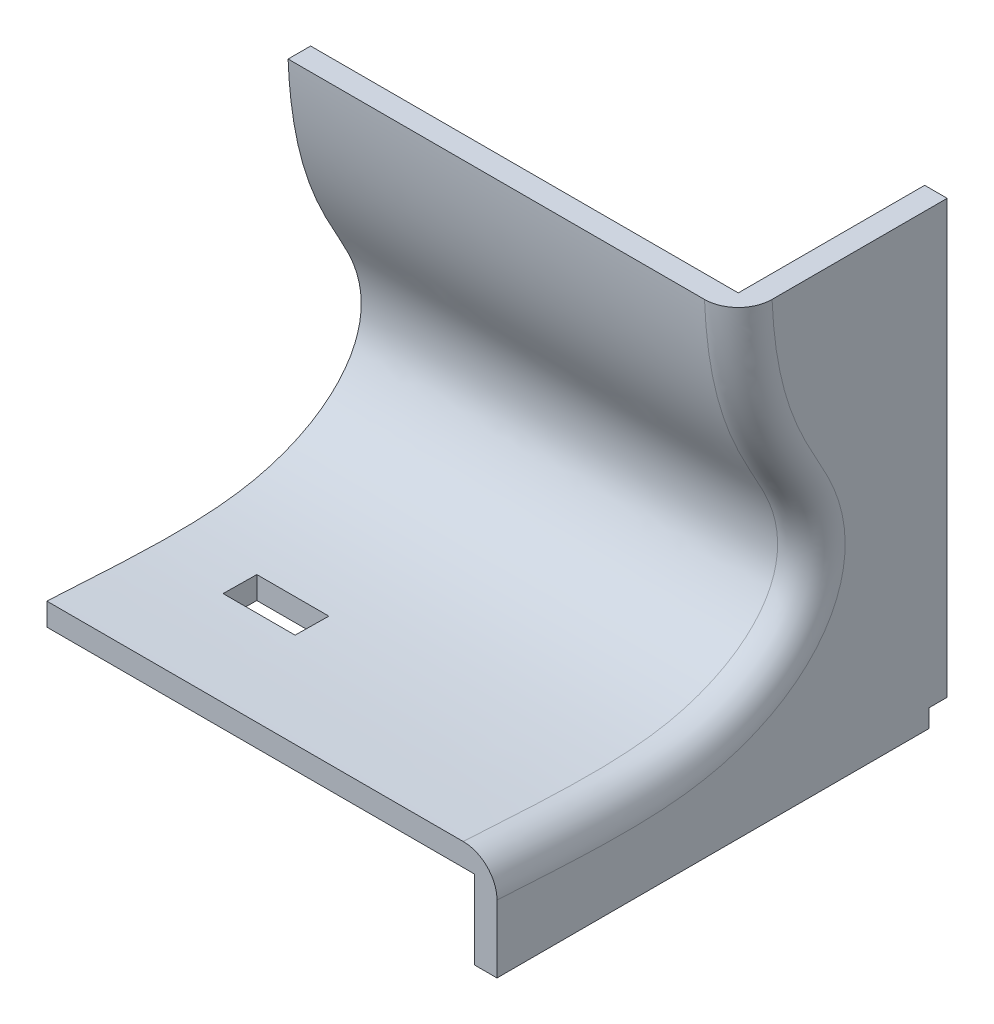
from build123d import *

# Parameters (mm, degrees)
SKETCH_1_W           = 80
SKETCH_1_H           = 100
EXTRUDE_1_DEPTH      = 100
SKETCH_2_W           = 80
SKETCH_2_H           = 85
CUT_EXTRUDE_1_DEPTH  = 90
CUT_EXTRUDE_5_DEPTH  = 138.477270849
SHELL_2_T            = -2
FILLET_1_R           = 3
FILLET_2_R           = 5
FILLET_3_R           = 3
SKETCH_6_W           = 3.8
SKETCH_6_H           = 2.5
CUT_EXTRUDE_6_DEPTH  = 85
SKETCH_8_W           = 6.4
SKETCH_8_H           = 3
CUT_EXTRUDE_7_DEPTH  = 100
SKETCH_11_W          = 2
SKETCH_11_H          = 1
CUT_EXTRUDE_8_DEPTH  = 119.74342103
SCALE_1_SCALE        = 5
SKETCH_12_W          = 400
SKETCH_12_H          = 300
SKETCH_12_W_2        = 185
SKETCH_12_H_2        = 29.670884313
CUT_EXTRUDE_11_DEPTH = 594.717104512
SKETCH_14_W          = 200
SKETCH_14_H          = 300
CUT_EXTRUDE_12_DEPTH = 575.45626481
SKETCH_15_W          = 8
SKETCH_15_H          = 8
CUT_EXTRUDE_13_DEPTH = 10


with BuildPart() as part:
    # 스케치1 → 보스-돌출1 (new body)
    with BuildSketch(Plane.XY):
        Rectangle(SKETCH_1_W, SKETCH_1_H)
    extrude(amount=-EXTRUDE_1_DEPTH)

    # 스케치2 → 컷-돌출1 (cut)
    with BuildSketch(Plane(origin=(40, 0, 0), x_dir=(0, 0, -1), z_dir=(1, 0, 0))):
        with Locations((40, 7.5)):
            Rectangle(SKETCH_2_W, SKETCH_2_H)
    extrude(amount=-CUT_EXTRUDE_1_DEPTH, mode=Mode.SUBTRACT)

    # 스케치5 → 컷-돌출5 (cut, through all)
    with BuildSketch(Plane(origin=(40, 0, 0), x_dir=(0, 0, -1), z_dir=(1, 0, 0))):
        with BuildLine():
            add(Edge.make_bspline(
                [(0, -39.376697629), (18.60893103, -37.813832642), (60.522018707, -41.448787519), (82.629316251, -41.815039561), (94.476954899, -29.981594577), (72.35205171, -11.407179683), (96, 50)],
                knots=[0, 0, 0, 0, 0.361871867, 0.526261735, 0.755385015, 1, 1, 1, 1], degree=3))
            Line((96, 50), (80, 50))
            Line((80, 50), (80, -35))
            Line((80, -35), (0, -35))
            Line((0, -35), (0, -39.376697629))
        make_face()
    extrude(amount=-CUT_EXTRUDE_5_DEPTH, mode=Mode.SUBTRACT)

    # 쉘2
    shell_2_openings = [part.faces().sort_by_distance(p)[0] for p in [
        (0, 0, -100),
        (0, -50, -50),
    ]]
    offset(amount=SHELL_2_T, openings=shell_2_openings, kind=Kind.INTERSECTION)

    # 필렛1
    fillet_1_edges = [part.edges().sort_by_distance(p)[0] for p in [
        (0, 50, -96),
    ]]
    fillet(fillet_1_edges, radius=FILLET_1_R)

    # 필렛2
    fillet_2_edges = [part.edges().sort_by_distance(p)[0] for p in [
        (0, -39.376697629, 0),
    ]]
    fillet(fillet_2_edges, radius=FILLET_2_R)

    # 필렛3
    fillet_3_edges = [part.edges().sort_by_distance(p)[0] for p in [
        (40, -47.032911569, 0),
        (40, 49.469386486, -96.360930071),
        (-40, 49.469386486, -96.360930071),
        (40, -34.292790316, -87.583679146),
        (-40, -34.292790311, -87.583679133),
        (40, -40.61329303, -1.383366779),
        (-40, -47.032911569, 0),
        (-40, -40.61329303, -1.383366779),
        (-40, 50, -99.032247048),
        (40, 50, -99.032247048),
    ]]
    fillet(fillet_3_edges, radius=FILLET_3_R)

    # 스케치6 → 컷-돌출6 (cut)
    with BuildSketch(Plane(origin=(0, 0, -100), x_dir=(-1, 0, 0), z_dir=(0, 0, -1))):
        with Locations((-10, 10)):
            Rectangle(SKETCH_6_W, SKETCH_6_H)
        with Locations((10, 10)):
            Rectangle(SKETCH_6_W, SKETCH_6_H)
    extrude(amount=-CUT_EXTRUDE_6_DEPTH, mode=Mode.SUBTRACT)

    # 스케치8 → 컷-돌출7 (cut)
    with BuildSketch(Plane(origin=(0, 50, 0), x_dir=(1, 0, 0), z_dir=(0, 1, 0))):
        with Locations((-10, 70.358931696)):
            Rectangle(SKETCH_8_W, SKETCH_8_H)
        with Locations((10, 70.358931696)):
            Rectangle(SKETCH_8_W, SKETCH_8_H)
    extrude(amount=-CUT_EXTRUDE_7_DEPTH, mode=Mode.SUBTRACT)

    # 스케치11 → 컷-돌출8 (cut, through all)
    with BuildSketch(Plane(origin=(0, 0, -100), x_dir=(-1, 0, 0), z_dir=(0, 0, -1))):
        with Locations((-10, 3.626900341)):
            Rectangle(SKETCH_11_W, SKETCH_11_H)
        with Locations((10, 3.626900341)):
            Rectangle(SKETCH_11_W, SKETCH_11_H)
    extrude(amount=-CUT_EXTRUDE_8_DEPTH, mode=Mode.SUBTRACT)


with BuildPart() as part_1:
    # 축척1: scaled about (0, 0, 0)
    add(part.part.scale(SCALE_1_SCALE))

    # 스케치12 → 컷-돌출11 (cut, through all)
    with BuildSketch(Plane.XY):
        with Locations((0, 100)):
            Rectangle(SKETCH_12_W, SKETCH_12_H)
        Polygon((0, -50), (-200, -50), (-200, -250), (-185, -250), (-185, -220.329115687), (0, -220.329115687), align=None)
        with Locations((-92.5, -235.164557844)):
            Rectangle(SKETCH_12_W_2, SKETCH_12_H_2)
    extrude(amount=-CUT_EXTRUDE_11_DEPTH, mode=Mode.SUBTRACT)

    # 스케치14 → 컷-돌출12 (cut, through all)
    with BuildSketch(Plane.XZ.offset(250)):
        with Locations((100, -150)):
            Rectangle(SKETCH_14_W, SKETCH_14_H)
    extrude(amount=-CUT_EXTRUDE_12_DEPTH, mode=Mode.SUBTRACT)

    # 스케치15 → 컷-돌출13 (cut)
    with BuildSketch(Plane(origin=(200, 0, 0), x_dir=(0, 0, -1), z_dir=(1, 0, 0))):
        with Locations((496, -246)):
            Rectangle(SKETCH_15_W, SKETCH_15_H)
    extrude(amount=-CUT_EXTRUDE_13_DEPTH, mode=Mode.SUBTRACT)


solid = part_1.part
